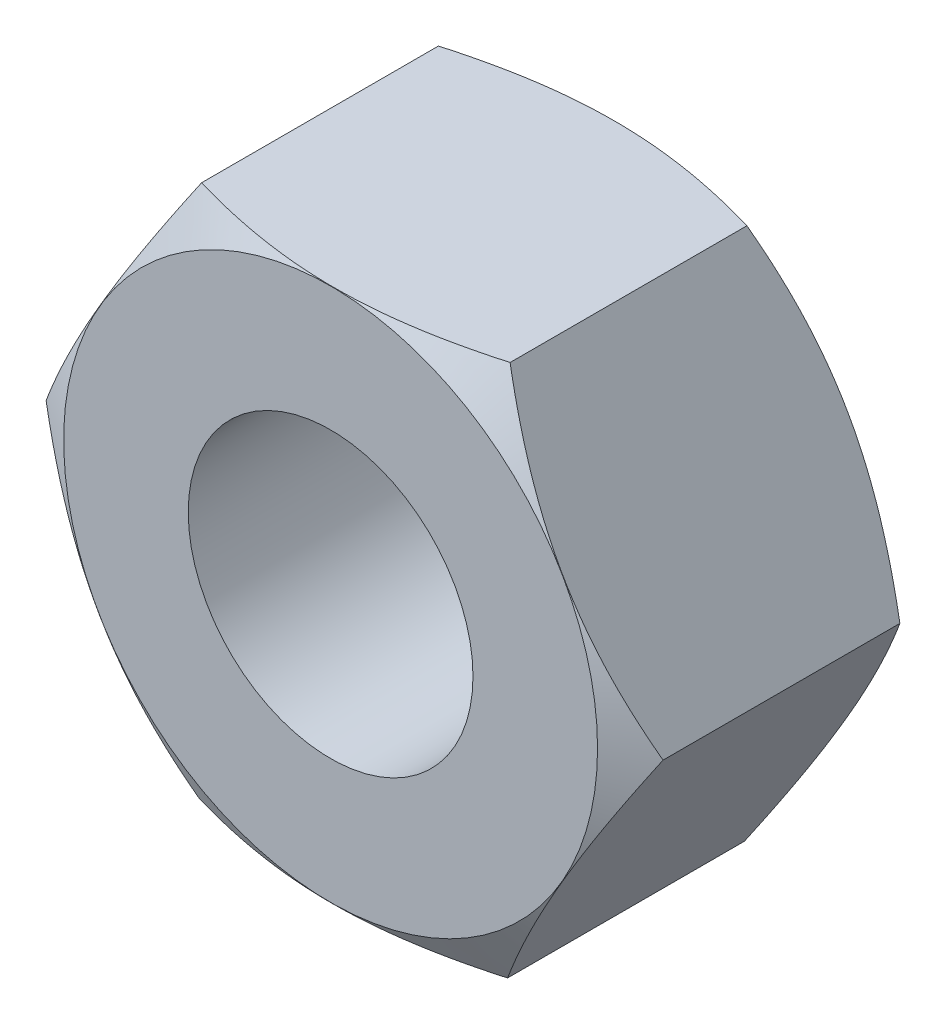
from build123d import *

# Parameters (mm, degrees)
SKETCH1_R           = 6
BOSS_EXTRUDE1_DEPTH = 12
SKETCH2_OUTSIDE_W   = 111.456
SKETCH2_OUTSIDE_H   = 108.034
SKETCH2_OUTSIDE_R   = 11.251897502
CUT_EXTRUDE1_DEPTH  = 21.986591899
CUT_EXTRUDE1_DRAFT  = -60
SKETCH3_OUTSIDE_W   = 111.456
SKETCH3_OUTSIDE_H   = 108.034
SKETCH3_OUTSIDE_R   = 11.25
CUT_EXTRUDE3_DEPTH  = 21.986591899
CUT_EXTRUDE3_DRAFT  = -60


with BuildPart() as part:
    # Sketch1 → Boss-Extrude1 (new body)
    with BuildSketch(Plane.XY):
        Polygon((6.552777772, 11.227858989), (-6.447222228, 11.28880151), (-13, 0.060942521), (-6.552777772, -11.227858989), (6.447222228, -11.28880151), (13, -0.060942521), align=None)
        Circle(SKETCH1_R, mode=Mode.SUBTRACT)
    extrude(amount=BOSS_EXTRUDE1_DEPTH)


with BuildPart() as cut_extrude1_tool:
    # Sketch2 outside → Cut-Extrude1 (with draft: the straight prism first)
    with BuildSketch(Plane(origin=(0, 0, 0), x_dir=(-1, 0, 0), z_dir=(0, 0, -1))):
        Rectangle(SKETCH2_OUTSIDE_W, SKETCH2_OUTSIDE_H)
        Circle(SKETCH2_OUTSIDE_R, mode=Mode.SUBTRACT)
    extrude(amount=-CUT_EXTRUDE1_DEPTH)
    # Cut-Extrude1: the draft: its side faces are tilted about the plane it starts from
    cut_extrude1_sides = [cut_extrude1_tool.faces().sort_by_distance(p)[0] for p in [
        (0, -54.017, 10.993295949),
        (-55.728, 0, 10.993295949),
        (0, 54.017, 10.993295949),
        (55.728, 0, 10.993295949),
        (11.251897502, 0, 10.993295949),
    ]]
    draft(cut_extrude1_sides, Plane(origin=(0, 0, 0), x_dir=(-1, 0, 0), z_dir=(0, 0, -1)), CUT_EXTRUDE1_DRAFT)


with BuildPart() as part_1:
    add(part.part)

    # Cut-Extrude1: cut by cut_extrude1_tool
    add(cut_extrude1_tool.part, mode=Mode.SUBTRACT)


with BuildPart() as cut_extrude3_tool:
    # Sketch3 outside → Cut-Extrude3 (with draft: the straight prism first)
    with BuildSketch(Plane.XY.offset(12)):
        Rectangle(SKETCH3_OUTSIDE_W, SKETCH3_OUTSIDE_H)
        Circle(SKETCH3_OUTSIDE_R, mode=Mode.SUBTRACT)
    extrude(amount=-CUT_EXTRUDE3_DEPTH)
    # Cut-Extrude3: the draft: its side faces are tilted about the plane it starts from
    cut_extrude3_sides = [cut_extrude3_tool.faces().sort_by_distance(p)[0] for p in [
        (0, -54.017, 1.006704051),
        (55.728, 0, 1.006704051),
        (0, 54.017, 1.006704051),
        (-55.728, 0, 1.006704051),
        (-11.25, 0, 1.006704051),
    ]]
    draft(cut_extrude3_sides, Plane.XY.offset(12), CUT_EXTRUDE3_DRAFT)


with BuildPart() as part_2:
    add(part_1.part)

    # Cut-Extrude3: cut by cut_extrude3_tool
    add(cut_extrude3_tool.part, mode=Mode.SUBTRACT)


solid = part_2.part
